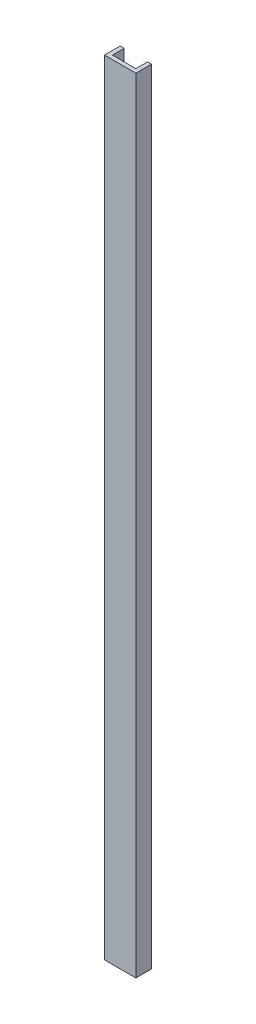
from build123d import *

# Parameters (mm, degrees)
BOSS_EXTRUDE2_DEPTH = 635


with BuildPart() as part:
    # Sketch3 → Boss-Extrude2 (new body)
    with BuildSketch(Plane(origin=(0, 0, 0), x_dir=(1, 0, 0), z_dir=(0, 1, 0))):
        Polygon((-37.836476992, -80.576106756), (-41.011476992, -80.576106756), (-41.011476992, -93.276106756), (-15.611476992, -93.276106756), (-15.611476992, -80.576106756), (-18.786476992, -80.576106756), (-18.786476992, -90.101106756), (-37.836476992, -90.101106756), align=None)
    extrude(amount=BOSS_EXTRUDE2_DEPTH)


solid = part.part
